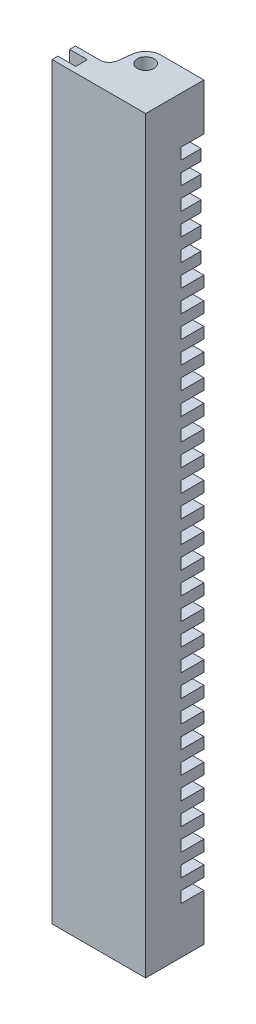
from build123d import *

# Parameters (mm, degrees)
BOSS_EXTRUDE1_DEPTH  = 203.2
SKETCH2_R            = 2.286
BOSS_EXTRUDE2_DEPTH  = 6.35
FILLET1_R            = 2.54
FILLET1_OF_MIRROR1_R = 2.54
SKETCH5_W            = 6.35
SKETCH5_H            = 9.597846327
CUT_EXTRUDE3_DEPTH   = 207.350575478
SKETCH3_W            = 6.277153673
SKETCH3_H            = 3.048
CUT_EXTRUDE1_DEPTH   = 205.701857736
SKETCH4_W            = 4.826
SKETCH4_H            = 3.175
CUT_EXTRUDE2_DEPTH   = 206.39013623
CHAMFER1_SIZE        = 0.762


with BuildPart() as part:
    # Sketch1 → Boss-Extrude1 (new body)
    with BuildSketch(Plane(origin=(0, 0, 0), x_dir=(1, 0, 0), z_dir=(0, 1, 0))):
        Polygon((0, 0), (25.4, 0), (25.4, 25.4), (19.05, 25.4), (19.05, 6.35), (0, 6.35), align=None)
    extrude(amount=BOSS_EXTRUDE1_DEPTH)

    # Sketch2 → Boss-Extrude2 (add)
    with BuildSketch(Plane(origin=(0, 203.2, 0), x_dir=(1, 0, 0), z_dir=(0, 1, 0))):
        with BuildLine():
            Line((19.05, 15.802153673), (19.05, 6.35))
            Line((19.05, 6.35), (8.89, 6.35))
            Line((8.89, 6.35), (9.629456844, 12.244049961))
            ThreePointArc((9.629456844, 12.244049961), (10.972967985, 14.785452355), (13.661846327, 15.802153673))
            Line((13.661846327, 15.802153673), (19.05, 15.802153673))
        make_face()
        with Locations(Location((13.661846327, 11.738153673, 0), (0, 0, 270))):
            Circle(SKETCH2_R, mode=Mode.SUBTRACT)
    boss_extrude2 = extrude(amount=-BOSS_EXTRUDE2_DEPTH)

    # Fillet1
    fillet1_edges = [part.edges().sort_by_distance(p)[0] for p in [
        (8.89, 200.025, -6.35),
    ]]
    fillet(fillet1_edges, radius=FILLET1_R)

    # Mirror1: Boss-Extrude2 across plane
    add(boss_extrude2.mirror(Plane.ZX.offset(101.6)))

    # Fillet1 of Mirror1
    fillet1_of_mirror1_edges = [part.edges().sort_by_distance(p)[0] for p in [
        (8.89, 3.175, -6.35),
    ]]
    fillet(fillet1_of_mirror1_edges, radius=FILLET1_OF_MIRROR1_R)

    # Sketch5 → Cut-Extrude3 (cut, through all)
    with BuildSketch(Plane(origin=(0, 203.2, 0), x_dir=(1, 0, 0), z_dir=(0, 1, 0))):
        with Locations((22.225, 20.601076837)):
            Rectangle(SKETCH5_W, SKETCH5_H)
    extrude(amount=-CUT_EXTRUDE3_DEPTH, mode=Mode.SUBTRACT)

    # Sketch3 → Cut-Extrude1 (cut, through all)
    with BuildSketch(Plane.ZY.offset(-19.05)):
        with Locations((-12.663576837, 188.976)):
            Rectangle(SKETCH3_W, SKETCH3_H)
        with Locations((-12.663576837, 182.950068966)):
            Rectangle(SKETCH3_W, SKETCH3_H)
        with Locations((-12.663576837, 176.924137931)):
            Rectangle(SKETCH3_W, SKETCH3_H)
        with Locations((-12.663576837, 170.898206897)):
            Rectangle(SKETCH3_W, SKETCH3_H)
        with Locations((-12.663576837, 164.872275862)):
            Rectangle(SKETCH3_W, SKETCH3_H)
        with Locations((-12.663576837, 158.846344828)):
            Rectangle(SKETCH3_W, SKETCH3_H)
        with Locations((-12.663576837, 152.820413793)):
            Rectangle(SKETCH3_W, SKETCH3_H)
        with Locations((-12.663576837, 146.794482759)):
            Rectangle(SKETCH3_W, SKETCH3_H)
        with Locations((-12.663576837, 140.768551724)):
            Rectangle(SKETCH3_W, SKETCH3_H)
        with Locations((-12.663576837, 134.74262069)):
            Rectangle(SKETCH3_W, SKETCH3_H)
        with Locations((-12.663576837, 128.716689655)):
            Rectangle(SKETCH3_W, SKETCH3_H)
        with Locations((-12.663576837, 122.690758621)):
            Rectangle(SKETCH3_W, SKETCH3_H)
        with Locations((-12.663576837, 116.664827586)):
            Rectangle(SKETCH3_W, SKETCH3_H)
        with Locations((-12.663576837, 110.638896552)):
            Rectangle(SKETCH3_W, SKETCH3_H)
        with Locations((-12.663576837, 104.612965517)):
            Rectangle(SKETCH3_W, SKETCH3_H)
        with Locations((-12.663576837, 98.587034483)):
            Rectangle(SKETCH3_W, SKETCH3_H)
        with Locations((-12.663576837, 92.561103448)):
            Rectangle(SKETCH3_W, SKETCH3_H)
        with Locations((-12.663576837, 86.535172414)):
            Rectangle(SKETCH3_W, SKETCH3_H)
        with Locations((-12.663576837, 80.509241379)):
            Rectangle(SKETCH3_W, SKETCH3_H)
        with Locations((-12.663576837, 74.483310345)):
            Rectangle(SKETCH3_W, SKETCH3_H)
        with Locations((-12.663576837, 68.45737931)):
            Rectangle(SKETCH3_W, SKETCH3_H)
        with Locations((-12.663576837, 62.431448276)):
            Rectangle(SKETCH3_W, SKETCH3_H)
        with Locations((-12.663576837, 56.405517241)):
            Rectangle(SKETCH3_W, SKETCH3_H)
        with Locations((-12.663576837, 50.379586207)):
            Rectangle(SKETCH3_W, SKETCH3_H)
        with Locations((-12.663576837, 44.353655172)):
            Rectangle(SKETCH3_W, SKETCH3_H)
        with Locations((-12.663576837, 38.327724138)):
            Rectangle(SKETCH3_W, SKETCH3_H)
        with Locations((-12.663576837, 32.301793103)):
            Rectangle(SKETCH3_W, SKETCH3_H)
        with Locations((-12.663576837, 26.275862069)):
            Rectangle(SKETCH3_W, SKETCH3_H)
        with Locations((-12.663576837, 20.249931034)):
            Rectangle(SKETCH3_W, SKETCH3_H)
        with Locations((-12.663576837, 14.224)):
            Rectangle(SKETCH3_W, SKETCH3_H)
    extrude(amount=-CUT_EXTRUDE1_DEPTH, mode=Mode.SUBTRACT)

    # Sketch4 → Cut-Extrude2 (cut, through all)
    with BuildSketch(Plane.XZ):
        with Locations((2.413, -3.175)):
            Rectangle(SKETCH4_W, SKETCH4_H)
    extrude(amount=-CUT_EXTRUDE2_DEPTH, mode=Mode.SUBTRACT)

    # Chamfer1
    chamfer1_edges = [part.edges().sort_by_distance(p)[0] for p in [
        (25.4, 161.859310345, -15.802153673),
        (25.4, 167.885241379, -15.802153673),
        (25.4, 173.911172414, -15.802153673),
        (25.4, 179.937103448, -15.802153673),
        (25.4, 185.963034483, -15.802153673),
        (19.05, 161.859310345, -15.802153673),
        (19.05, 167.885241379, -15.802153673),
        (19.05, 173.911172414, -15.802153673),
        (19.05, 179.937103448, -15.802153673),
        (19.05, 185.963034483, -15.802153673),
        (22.225, 187.452, -15.802153673),
        (22.225, 160.370344828, -15.802153673),
        (22.225, 166.396275862, -15.802153673),
        (22.225, 163.348275862, -15.802153673),
        (22.225, 184.474068966, -15.802153673),
        (22.225, 181.426068966, -15.802153673),
        (22.225, 178.448137931, -15.802153673),
        (22.225, 175.400137931, -15.802153673),
        (22.225, 172.422206897, -15.802153673),
        (22.225, 169.374206897, -15.802153673),
    ]]
    chamfer(chamfer1_edges, length=CHAMFER1_SIZE)


solid = part.part
